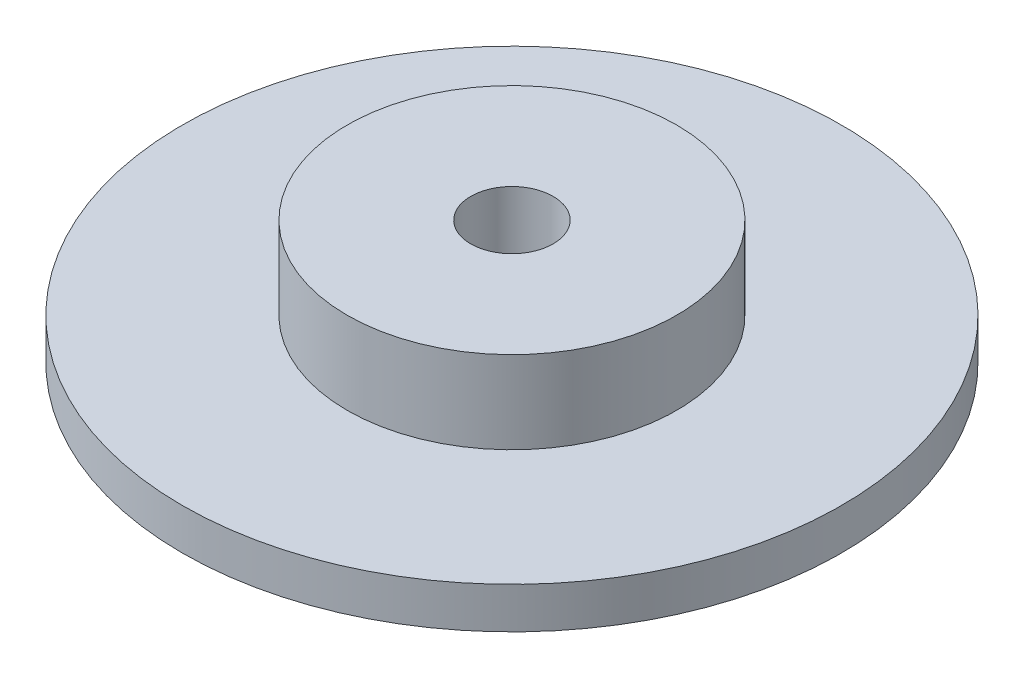
from build123d import *

# Parameters (mm, degrees)
SKETCH1_R           = 25.4
BOSS_EXTRUDE1_DEPTH = 3.175
SKETCH2_R           = 12.7
BOSS_EXTRUDE2_DEPTH = 6.35
SKETCH3_R           = 3.175
CUT_EXTRUDE1_DEPTH  = 38.162422217


with BuildPart() as part:
    # Sketch1 → Boss-Extrude1 (new body)
    with BuildSketch(Plane(origin=(0, 0, 0), x_dir=(1, 0, 0), z_dir=(0, 1, 0))):
        with Locations(Location((0, 0, 0), (0, 0, 270))):
            Circle(SKETCH1_R)
    extrude(amount=BOSS_EXTRUDE1_DEPTH)

    # Sketch2 → Boss-Extrude2 (add)
    with BuildSketch(Plane(origin=(0, 3.175, 0), x_dir=(1, 0, 0), z_dir=(0, 1, 0))):
        with Locations(Location((0, 0, 0), (0, 0, 270))):
            Circle(SKETCH2_R)
    extrude(amount=BOSS_EXTRUDE2_DEPTH)

    # Sketch3 → Cut-Extrude1 (cut, through all)
    with BuildSketch(Plane(origin=(0, 9.525, 0), x_dir=(1, 0, 0), z_dir=(0, 1, 0))):
        with Locations(Location((0, 0, 0), (0, 0, 270))):
            Circle(SKETCH3_R)
    extrude(amount=-CUT_EXTRUDE1_DEPTH, mode=Mode.SUBTRACT)


solid = part.part
